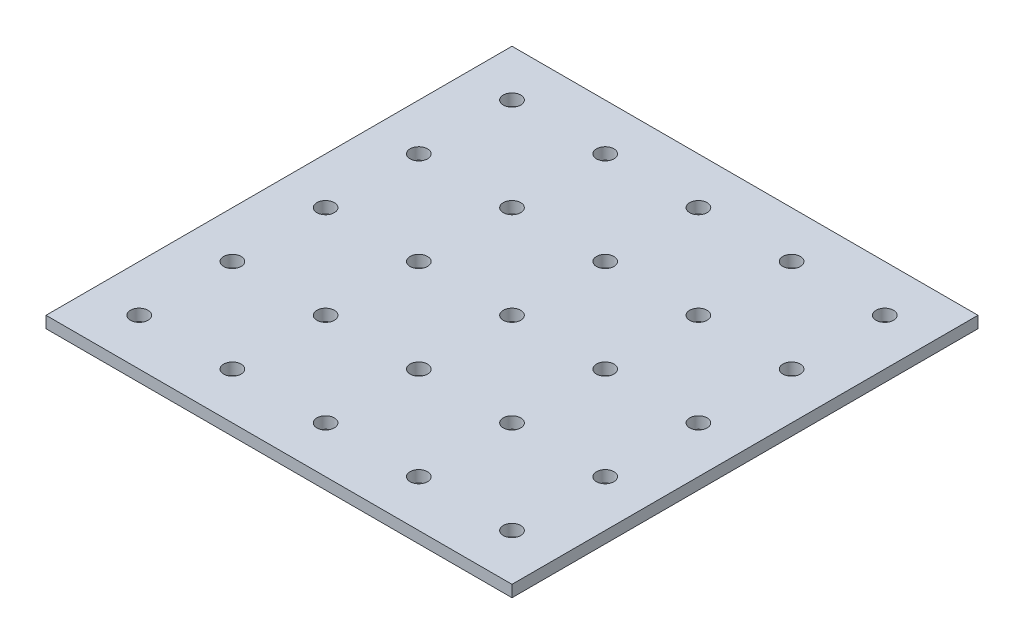
from build123d import *

# Parameters (mm, degrees)
SKETCH1_W               = 127
SKETCH1_H               = 127
BOSS_EXTRUDE1_DEPTH     = 3.175
CUT_EXTRUDE3_DEPTH      = 3.175
CUT_EXTRUDE3_DEPTH_BACK = 90.858670283
SKETCH2_R               = 2.38125


with BuildPart() as part:
    # Sketch1 → Boss-Extrude1 (new body)
    with BuildSketch(Plane(origin=(0, 0, 0), x_dir=(1, 0, 0), z_dir=(0, 1, 0))):
        Rectangle(SKETCH1_W, SKETCH1_H)
    extrude(amount=BOSS_EXTRUDE1_DEPTH)

    # Sketch2 → Cut-Extrude3 (cut, two sides: drawn at the far end of the back side and taken through both)
    with BuildSketch(Plane(origin=(0, 0, 0), x_dir=(1, 0, 0), z_dir=(0, 1, 0)).offset(-CUT_EXTRUDE3_DEPTH_BACK)):
        with Locations(Location((-50.8, -50.8, 0), (0, 0, 270))):
            Circle(SKETCH2_R)
        with Locations(Location((-25.4, -50.8, 0), (0, 0, 270))):
            Circle(SKETCH2_R)
        with Locations(Location((0, -50.8, 0), (0, 0, 270))):
            Circle(SKETCH2_R)
        with Locations(Location((25.4, -50.8, 0), (0, 0, 270))):
            Circle(SKETCH2_R)
        with Locations(Location((50.8, -50.8, 0), (0, 0, 270))):
            Circle(SKETCH2_R)
        with Locations(Location((-25.4, -25.4, 0), (0, 0, 270))):
            Circle(SKETCH2_R)
        with Locations(Location((0, -25.4, 0), (0, 0, 270))):
            Circle(SKETCH2_R)
        with Locations(Location((25.4, -25.4, 0), (0, 0, 270))):
            Circle(SKETCH2_R)
        with Locations(Location((50.8, -25.4, 0), (0, 0, 270))):
            Circle(SKETCH2_R)
        with Locations(Location((-25.4, 0, 0), (0, 0, 270))):
            Circle(SKETCH2_R)
        with Locations(Location((0, 0, 0), (0, 0, 270))):
            Circle(SKETCH2_R)
        with Locations(Location((25.4, 0, 0), (0, 0, 270))):
            Circle(SKETCH2_R)
        with Locations(Location((50.8, 0, 0), (0, 0, 270))):
            Circle(SKETCH2_R)
        with Locations(Location((-25.4, 25.4, 0), (0, 0, 270))):
            Circle(SKETCH2_R)
        with Locations(Location((0, 25.4, 0), (0, 0, 270))):
            Circle(SKETCH2_R)
        with Locations(Location((25.4, 25.4, 0), (0, 0, 270))):
            Circle(SKETCH2_R)
        with Locations(Location((50.8, 25.4, 0), (0, 0, 270))):
            Circle(SKETCH2_R)
        with Locations(Location((-25.4, 50.8, 0), (0, 0, 270))):
            Circle(SKETCH2_R)
        with Locations(Location((0, 50.8, 0), (0, 0, 270))):
            Circle(SKETCH2_R)
        with Locations(Location((25.4, 50.8, 0), (0, 0, 270))):
            Circle(SKETCH2_R)
        with Locations(Location((50.8, 50.8, 0), (0, 0, 270))):
            Circle(SKETCH2_R)
        with Locations(Location((-50.8, -25.4, 0), (0, 0, 270))):
            Circle(SKETCH2_R)
        with Locations(Location((-50.8, 0, 0), (0, 0, 270))):
            Circle(SKETCH2_R)
        with Locations(Location((-50.8, 25.4, 0), (0, 0, 270))):
            Circle(SKETCH2_R)
        with Locations(Location((-50.8, 50.8, 0), (0, 0, 270))):
            Circle(SKETCH2_R)
    extrude(amount=CUT_EXTRUDE3_DEPTH + CUT_EXTRUDE3_DEPTH_BACK, mode=Mode.SUBTRACT)


solid = part.part
